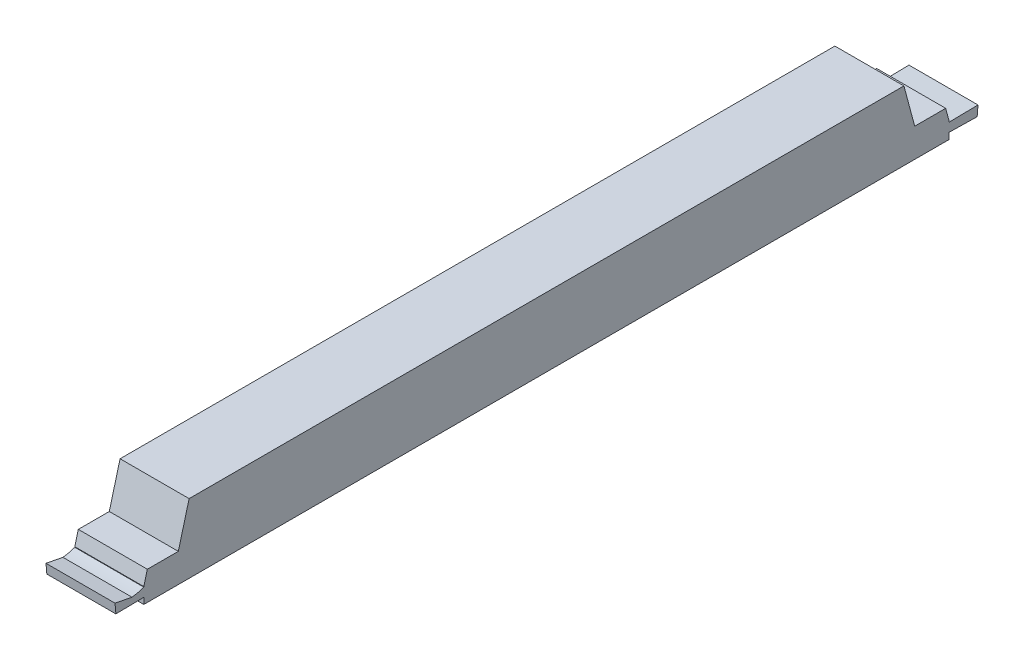
from build123d import *

# Parameters (mm, degrees)
SKETCH1_W          = 12
SKETCH1_H          = 12
EXTRUDE1_DEPTH     = 150
SKETCH2_W          = 5
SKETCH2_H          = 1
CUT_EXTRUDE2_DEPTH = 151.956947505
CUT_EXTRUDE3_DEPTH = 151.956947505
CUT_EXTRUDE4_DEPTH = 151.956947505
CUT_EXTRUDE5_DEPTH = 151.956947505


with BuildPart() as part:
    # Sketch1 → Extrude1 (new body)
    with BuildSketch(Plane.XY):
        with Locations((6, 6)):
            Rectangle(SKETCH1_W, SKETCH1_H)
    extrude(amount=EXTRUDE1_DEPTH)

    # Sketch2 → Cut-Extrude2 (cut, through all)
    with BuildSketch(Plane(origin=(12, 0, 0), x_dir=(0, 0, -1), z_dir=(1, 0, 0))):
        with Locations((-2.5, 0.5)):
            Rectangle(SKETCH2_W, SKETCH2_H)
        with Locations((-147.5, 0.5)):
            Rectangle(SKETCH2_W, SKETCH2_H)
    extrude(amount=-CUT_EXTRUDE2_DEPTH, mode=Mode.SUBTRACT)

    # Sketch3 → Cut-Extrude3 (cut, through all)
    with BuildSketch(Plane(origin=(12, 0, 0), x_dir=(0, 0, -1), z_dir=(1, 0, 0))):
        Polygon((-150, 2.7), (-145, 2.7), (-144.383716857, 5), (-139, 5), (-137.124355653, 12), (-150, 12), align=None)
        Polygon((0, 2.7), (-5, 2.7), (-5.616283143, 5), (-11, 5), (-12.875644347, 12), (0, 12), align=None)
    extrude(amount=-CUT_EXTRUDE3_DEPTH, mode=Mode.SUBTRACT)

    # Sketch4 → Cut-Extrude4 (cut, through all)
    with BuildSketch(Plane(origin=(12, 0, 0), x_dir=(0, 0, -1), z_dir=(1, 0, 0))):
        Polygon((-145, 1), (-145, 1.087275325), (-150, 1), align=None)
        Polygon((-145, 2.7), (-145, 2.612724675), (-150, 2.7), align=None)
        Polygon((-5, 2.7), (-5, 2.612724675), (0, 2.7), align=None)
        Polygon((-5, 1), (-5, 1.087275325), (0, 1), align=None)
    extrude(amount=-CUT_EXTRUDE4_DEPTH, mode=Mode.SUBTRACT)

    # Sketch5 → Cut-Extrude5 (cut, through all)
    with BuildSketch(Plane(origin=(12, 0, 0), x_dir=(0, 0, -1), z_dir=(1, 0, 0))):
        Polygon((-149.851496055, 1.002592146), (-150, 2.7), (-150, 1), align=None)
        with BuildLine():
            Line((-145, 2.612724675), (-150, 2.7))
            Line((-150, 2.7), (-147.05511845, 2.127573014))
            ThreePointArc((-147.05511845, 2.127573014), (-146.011481885, 2.302044703), (-145, 2.612724675))
        make_face()
        Polygon((0, 1), (0, 2.7), (-0.148503945, 1.002592146), align=None)
    extrude(amount=-CUT_EXTRUDE5_DEPTH, mode=Mode.SUBTRACT)


solid = part.part
